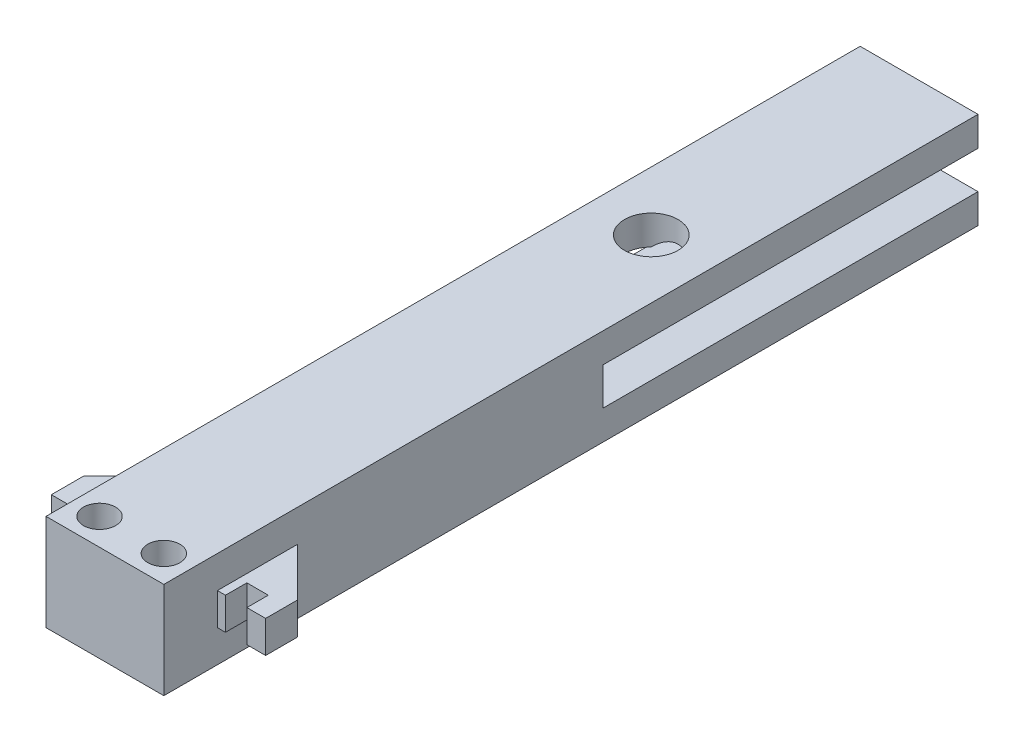
from build123d import *

# Parameters (mm, degrees)
SKETCH1_W           = 11
SKETCH1_H           = 76
BOSS_EXTRUDE1_DEPTH = 9
SKETCH4_R           = 2.5
SKETCH5_W           = 3
SKETCH5_H           = 3
BOSS_EXTRUDE2_DEPTH = 4.5
SKETCH6_W           = 2
SKETCH6_H           = 3
CUT_EXTRUDE2_DEPTH  = 2
BOSS_EXTRUDE3_DEPTH = 3
SKETCH10_W          = 11
SKETCH10_H          = 3.5
CUT_EXTRUDE5_DEPTH  = 35
CUT_EXTRUDE6_REACH  = 42.311
SKETCH11_R          = 2.5
CUT_EXTRUDE8_REACH  = 42.311
SKETCH8_R           = 1.5


with BuildPart() as part:
    # Sketch1 → Boss-Extrude1 (new body)
    with BuildSketch(Plane(origin=(0, 0, 0), x_dir=(1, 0, 0), z_dir=(0, 1, 0))):
        Rectangle(SKETCH1_W, SKETCH1_H)
    extrude(amount=BOSS_EXTRUDE1_DEPTH)

    # Cut-Sweep2: sweep along a path in Sketch3
    with BuildLine(Plane.ZY) as cut_sweep2_path:
        Line((-38, 4.5), (27, 4.5))
        ThreePointArc((27, 4.5), (29.828427125, 3.328427125), (31, 0.5))
        Line((31, 0.5), (31, 0))
    # Sketch4 → Cut-Sweep2 (sweep, cut)
    with BuildSketch(Plane(origin=(0, 0, -38), x_dir=(-1, 0, 0), z_dir=(0, 0, -1))):
        with Locations((0, 4.5)):
            Circle(SKETCH4_R)
    sweep(path=cut_sweep2_path.line, mode=Mode.SUBTRACT)

    # Sketch5 → Boss-Extrude2 (add)
    with BuildSketch(Plane.ZY.offset(5.5)):
        with Locations((31.5, 4.5)):
            Rectangle(SKETCH5_W, SKETCH5_H)
    boss_extrude2 = extrude(amount=BOSS_EXTRUDE2_DEPTH)

    # Mirror1: Boss-Extrude2 across plane
    add(boss_extrude2.mirror(Plane.ZY))

    # Sketch6 → Cut-Extrude2 (cut)
    with BuildSketch(Plane.XY.offset(33)):
        with Locations((-7.25, 4.5)):
            Rectangle(SKETCH6_W, SKETCH6_H)
    cut_extrude2 = extrude(amount=-CUT_EXTRUDE2_DEPTH, mode=Mode.SUBTRACT)

    # Mirror2: Cut-Extrude2 across plane
    add(cut_extrude2.mirror(Plane.ZY), mode=Mode.SUBTRACT)

    # Sketch7 → Boss-Extrude3 (add)
    with BuildSketch(Plane(origin=(0, 6, 0), x_dir=(1, 0, 0), z_dir=(0, 1, 0))):
        Polygon((-10, -30), (-5.5, -25.5), (-5.5, -30), align=None)
    boss_extrude3 = extrude(amount=-BOSS_EXTRUDE3_DEPTH)

    # Mirror3: Boss-Extrude3 across plane
    add(boss_extrude3.mirror(Plane.ZY))

    # Sketch10 → Cut-Extrude5 (cut)
    with BuildSketch(Plane(origin=(0, 0, -38), x_dir=(-1, 0, 0), z_dir=(0, 0, -1))):
        with Locations((0, 4.5)):
            Rectangle(SKETCH10_W, SKETCH10_H)
    extrude(amount=-CUT_EXTRUDE5_DEPTH, mode=Mode.SUBTRACT)

    # Sketch11 → Cut-Extrude6 (cut, up to next)
    with BuildSketch(Plane(origin=(0, 9, 0), x_dir=(1, 0, 0), z_dir=(0, 1, 0)), mode=Mode.PRIVATE) as cut_extrude6_sk1:
        with Locations(Location((0, 13, 0), (0, 0, 270))):
            Circle(SKETCH11_R)
    cut_extrude6_tool1 = extrude(cut_extrude6_sk1.sketch, amount=-CUT_EXTRUDE6_REACH, mode=Mode.PRIVATE) & part.part
    add(cut_extrude6_tool1.solids().sort_by_distance((0, 9, -13))[0], mode=Mode.SUBTRACT)

    # Sketch8 → Cut-Extrude8 (cut, up to next)
    with BuildSketch(Plane.XZ, mode=Mode.PRIVATE) as cut_extrude8_sk1:
        with Locations(Location((-3, 35.5, 0), (0, 0, 270))):
            Circle(SKETCH8_R)
    cut_extrude8_tool1 = extrude(cut_extrude8_sk1.sketch, amount=-CUT_EXTRUDE8_REACH, mode=Mode.PRIVATE) & part.part
    # Sketch8 → Cut-Extrude8 (cut, up to next)
    with BuildSketch(Plane.XZ, mode=Mode.PRIVATE) as cut_extrude8_sk2:
        with Locations(Location((3, 35.5, 0), (0, 0, 90))):
            Circle(SKETCH8_R)
    cut_extrude8_tool2 = extrude(cut_extrude8_sk2.sketch, amount=-CUT_EXTRUDE8_REACH, mode=Mode.PRIVATE) & part.part
    add(cut_extrude8_tool1.solids().sort_by_distance((-3, 0, 35.5))[0], mode=Mode.SUBTRACT)
    add(cut_extrude8_tool2.solids().sort_by_distance((3, 0, 35.5))[0], mode=Mode.SUBTRACT)


solid = part.part
